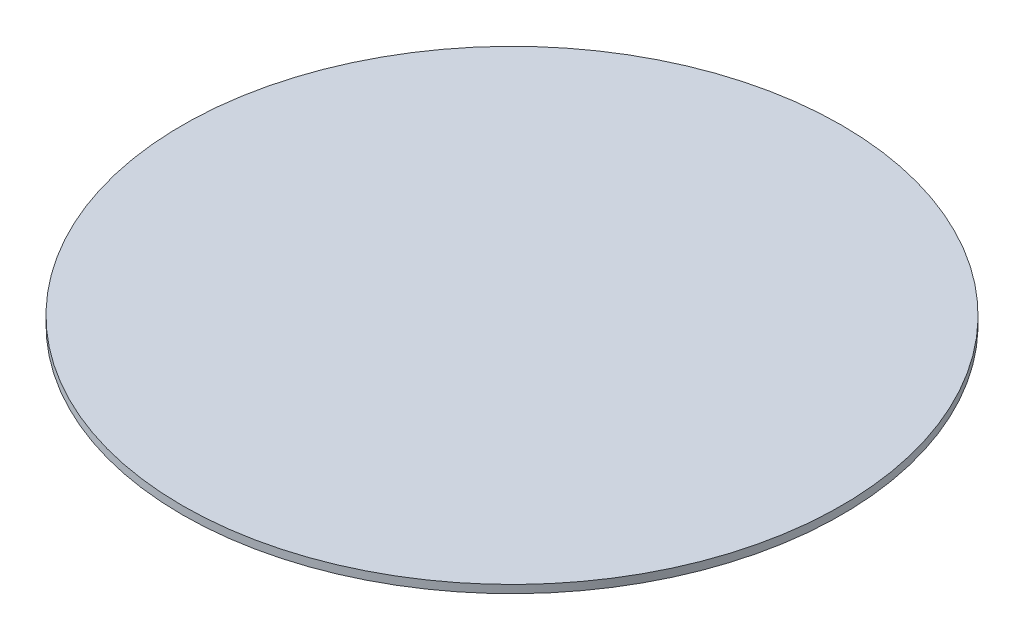
from build123d import *

# Parameters (mm, degrees)
ESQUISSE1_R        = 41.25
BOSS_EXTRU_1_DEPTH = 1


with BuildPart() as part:
    # Esquisse1 → Boss.-Extru.1 (new body)
    with BuildSketch(Plane(origin=(0, 0, 0), x_dir=(1, 0, 0), z_dir=(0, 1, 0))):
        with Locations(Location((0, 0, 0), (0, 0, 270))):
            Circle(ESQUISSE1_R)
    extrude(amount=BOSS_EXTRU_1_DEPTH)


solid = part.part
